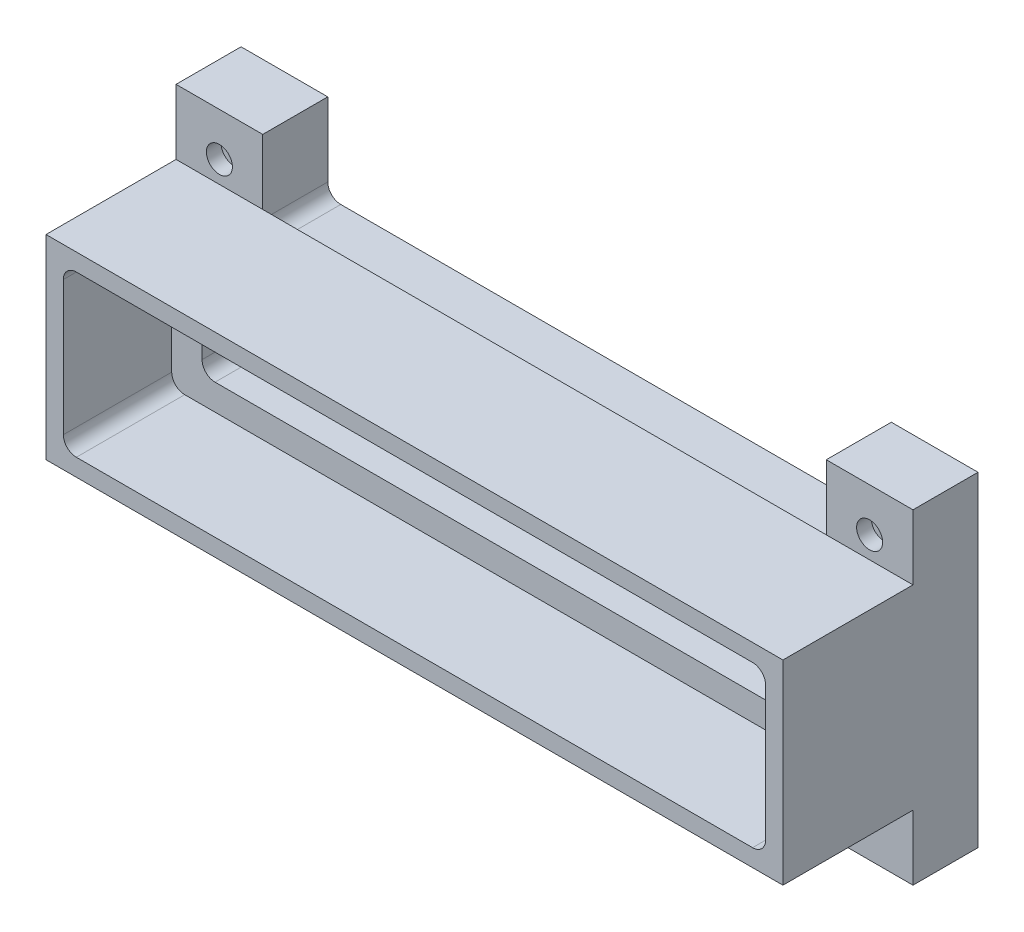
from build123d import *

# Parameters (mm, degrees)
SKETCH1_W                                            = 170
SKETCH1_H                                            = 75
BOSS_EXTRUDE1_DEPTH                                  = 15
SKETCH2_W                                            = 130
SKETCH2_H                                            = 20
CUT_EXTRUDE1_DEPTH                                   = 95.107651124
CBORE_FOR_M3_HEXAGON_SOCKET_HEAD_CAP_SCR_D           = 3.2
CBORE_FOR_M3_HEXAGON_SOCKET_HEAD_CAP_SCR_CBORE_D     = 6
CBORE_FOR_M3_HEXAGON_SOCKET_HEAD_CAP_SCR_CBORE_DEPTH = 3.4
MIRROR2_AT_THE_SECOND_PLANE_COPY_1_D                 = 3.2
MIRROR2_AT_THE_SECOND_PLANE_COPY_1_CBORE_D           = 6
MIRROR2_AT_THE_SECOND_PLANE_COPY_1_CBORE_DEPTH       = 3.4
FILLET1_R                                            = 3
SKETCH9_W                                            = 170
SKETCH9_H                                            = 45
BOSS_EXTRUDE3_DEPTH                                  = 30
SKETCH8_W                                            = 148
SKETCH8_H                                            = 25
CUT_EXTRUDE2_DEPTH                                   = 104.22911411
SKETCH10_W                                           = 162
SKETCH10_H                                           = 37
CUT_EXTRUDE3_DEPTH                                   = 25
FILLET2_R                                            = 3


with BuildPart() as part:
    # Sketch1 → Boss-Extrude1 (new body)
    with BuildSketch(Plane.XY):
        Rectangle(SKETCH1_W, SKETCH1_H)
    extrude(amount=BOSS_EXTRUDE1_DEPTH)

    # Sketch2 → Cut-Extrude1 (cut, through all)
    with BuildSketch(Plane.XY.offset(15)):
        with Locations((0, -27.5)):
            Rectangle(SKETCH2_W, SKETCH2_H)
    cut_extrude1 = extrude(amount=-CUT_EXTRUDE1_DEPTH, mode=Mode.SUBTRACT)

    # Mirror1: Cut-Extrude1 across plane
    add(cut_extrude1.mirror(Plane.ZX), mode=Mode.SUBTRACT)

    # CBORE for M3 Hexagon socket head cap screws1 (through all)
    with Locations(Plane.XY.offset(15)):
        with Locations((-75, 27.5)):
            cbore_for_m3_hexagon_socket_head_cap_scr = CounterBoreHole(CBORE_FOR_M3_HEXAGON_SOCKET_HEAD_CAP_SCR_D / 2, CBORE_FOR_M3_HEXAGON_SOCKET_HEAD_CAP_SCR_CBORE_D / 2, CBORE_FOR_M3_HEXAGON_SOCKET_HEAD_CAP_SCR_CBORE_DEPTH)

    # Mirror2: CBORE for M3 Hexagon socket head cap screws1 across plane
    add(cbore_for_m3_hexagon_socket_head_cap_scr.mirror(Plane(origin=(0, 0, 0), x_dir=(0, 0, 1), z_dir=(1, 0, 0))), mode=Mode.SUBTRACT)

    # Mirror2 at the second plane: CBORE for M3 Hexagon socket head cap screws1 across plane
    add(cbore_for_m3_hexagon_socket_head_cap_scr.mirror(Plane.ZX), mode=Mode.SUBTRACT)

    # Mirror2 at the second plane copy 1 (through all)
    with Locations(Plane(origin=(0, 0, 15), x_dir=(-1, 0, 0), z_dir=(0, 0, 1))):
        with Locations((-75, 27.5)):
            CounterBoreHole(MIRROR2_AT_THE_SECOND_PLANE_COPY_1_D / 2, MIRROR2_AT_THE_SECOND_PLANE_COPY_1_CBORE_D / 2, MIRROR2_AT_THE_SECOND_PLANE_COPY_1_CBORE_DEPTH)

    # Fillet1
    fillet1_edges = [part.edges().sort_by_distance(p)[0] for p in [
        (-65, -17.5, 7.5),
        (65, -17.5, 7.5),
        (-65, 17.5, 7.5),
        (65, 17.5, 7.5),
    ]]
    fillet(fillet1_edges, radius=FILLET1_R)

    # Sketch9 → Boss-Extrude3 (add)
    with BuildSketch(Plane.XY.offset(15)):
        Rectangle(SKETCH9_W, SKETCH9_H)
    extrude(amount=BOSS_EXTRUDE3_DEPTH)

    # Sketch8 → Cut-Extrude2 (cut, through all)
    with BuildSketch(Plane(origin=(0, 0, 0), x_dir=(-1, 0, 0), z_dir=(0, 0, -1))):
        Rectangle(SKETCH8_W, SKETCH8_H)
    extrude(amount=-CUT_EXTRUDE2_DEPTH, mode=Mode.SUBTRACT)

    # Sketch10 → Cut-Extrude3 (cut)
    with BuildSketch(Plane.XY.offset(45)):
        Rectangle(SKETCH10_W, SKETCH10_H)
    extrude(amount=-CUT_EXTRUDE3_DEPTH, mode=Mode.SUBTRACT)

    # Fillet2
    fillet2_edges = [part.edges().sort_by_distance(p)[0] for p in [
        (-74, -12.5, 10),
        (74, -12.5, 10),
        (-74, 12.5, 10),
        (74, 12.5, 10),
        (-81, -18.5, 32.5),
        (-81, 18.5, 32.5),
        (81, 18.5, 32.5),
        (81, -18.5, 32.5),
    ]]
    fillet(fillet2_edges, radius=FILLET2_R)


solid = part.part
